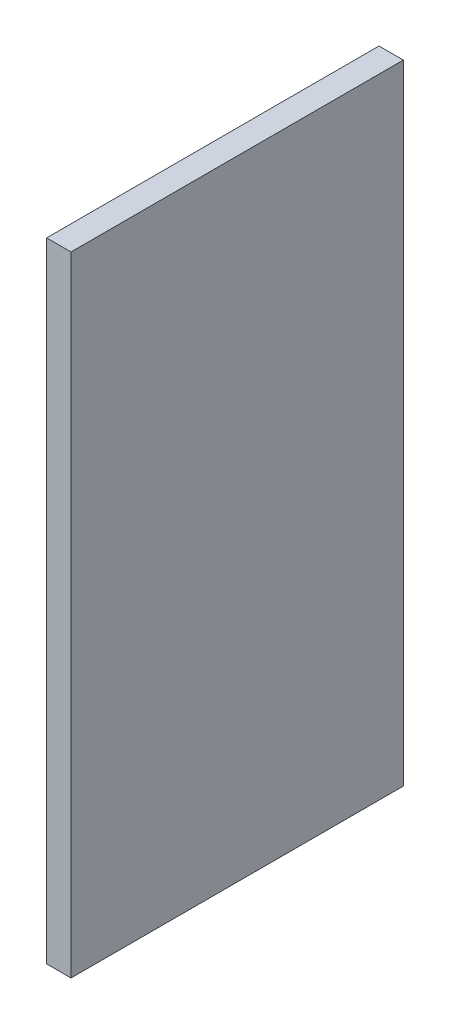
from build123d import *

# Parameters (mm, degrees)
SKETCH1_W                = 60
SKETCH1_H                = 1548.5
STORE_PU_YAN_SAG_1_DEPTH = 818.5


with BuildPart() as part:
    # Sketch1 → STORE_pu_yan_sag_1 (new body)
    with BuildSketch(Plane.XY):
        with Locations((1368.5, 895.75)):
            Rectangle(SKETCH1_W, SKETCH1_H)
    extrude(amount=-STORE_PU_YAN_SAG_1_DEPTH)


solid = part.part
